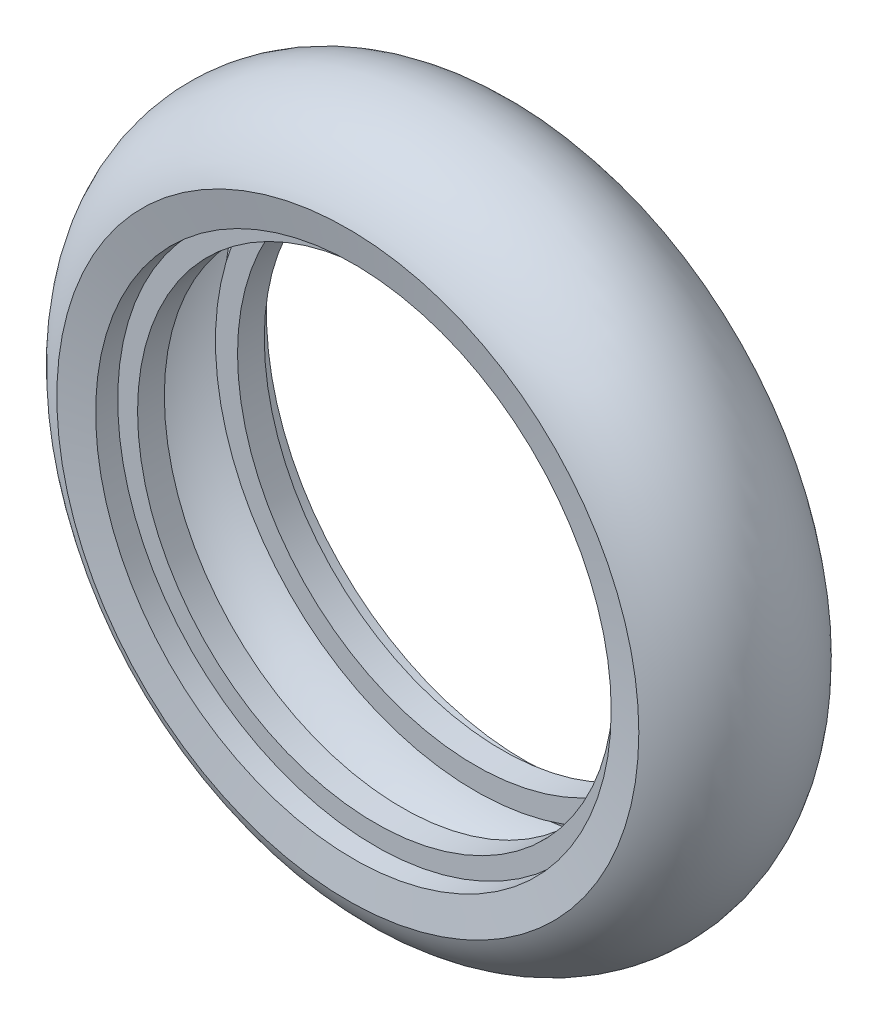
from build123d import *


with BuildPart() as part:
    # Schizzo1 → Rivoluzione1 (revolve)
    with BuildSketch(Plane(origin=(0, 0, 0), x_dir=(0, 0, -1), z_dir=(1, 0, 0)), mode=Mode.PRIVATE) as rivoluzione1_sk:
        with BuildLine():
            Line((-16.5, -6.875), (-15.485, -0.855))
            Line((-15.485, -0.855), (-11.485, -0.855))
            Line((-11.485, -0.855), (-11.485, 2.745))
            Line((-11.485, 2.745), (-6.635, 2.745))
            Line((-6.635, 2.745), (-6.635, -1.255))
            Line((-6.635, -1.255), (-12.526753167, -1.353774175))
            Line((-12.526753167, -1.353774175), (-13.390622261, -6.477411556))
            ThreePointArc((-13.390622261, -6.477411556), (-7.902978176, -12.601926874), (0, -14.875))
            ThreePointArc((0, -14.875), (7.902978176, -12.601926874), (13.390622261, -6.477411556))
            Line((13.390622261, -6.477411556), (12.526753167, -1.353774175))
            Line((12.526753167, -1.353774175), (6.635, -1.255))
            Line((6.635, -1.255), (6.635, 2.745))
            Line((6.635, 2.745), (11.485, 2.745))
            Line((11.485, 2.745), (11.485, -0.855))
            Line((11.485, -0.855), (15.485, -0.855))
            Line((15.485, -0.855), (16.5, -6.875))
            ThreePointArc((16.5, -6.875), (9.915266008, -14.872899011), (0, -17.875))
            ThreePointArc((0, -17.875), (-9.915266008, -14.872899011), (-16.5, -6.875))
        make_face()
    revolve(rivoluzione1_sk.sketch.rotate(Axis((0, 45.875, 83.136994768), (0, 0, -1)), 270), axis=Axis((0, 45.875, 83.136994768), (0, 0, -1)))


solid = part.part
